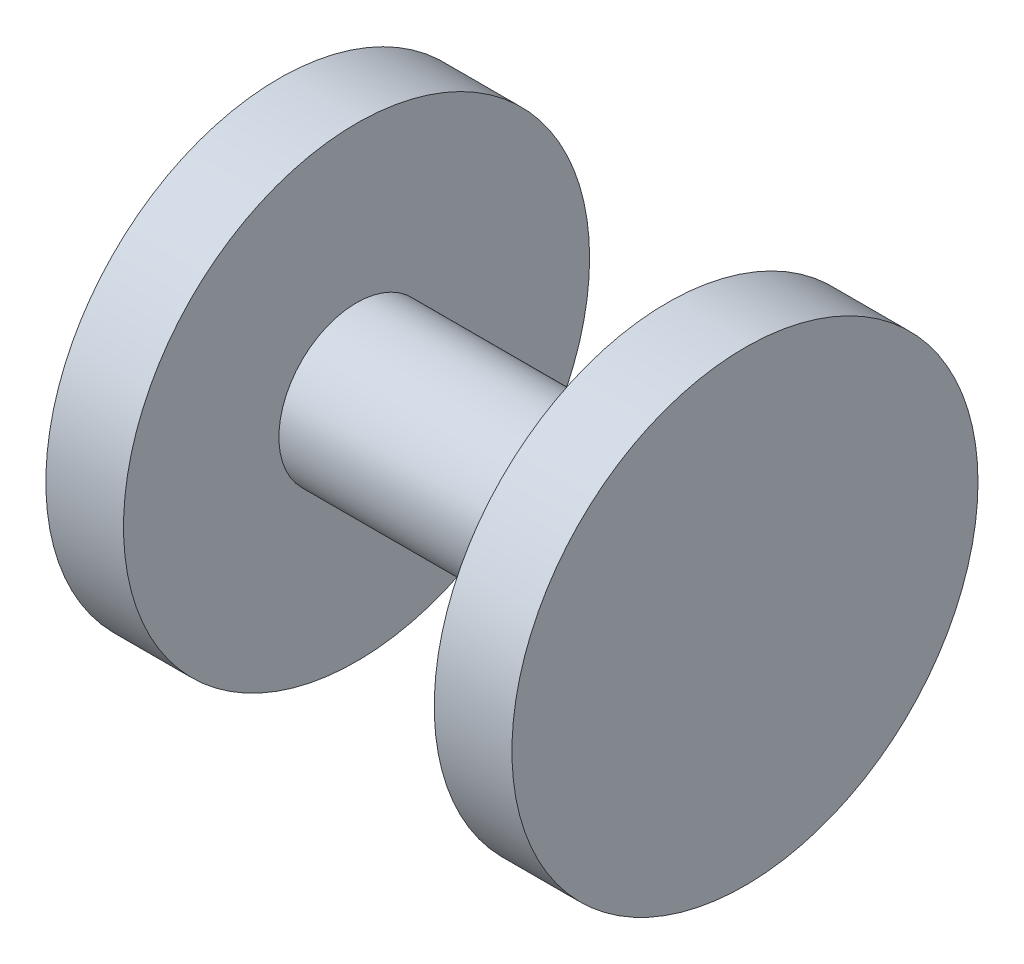
from build123d import *


with BuildPart() as part:
    # Croquis1 → Revolución1 (revolve)
    with BuildSketch(Plane.XY, mode=Mode.PRIVATE) as revoluci_n1_sk:
        Polygon((0, 0), (0, 15), (5, 15), (5, 5), (25, 5), (25, 15), (30, 15), (30, 0), align=None)
    revolve(revoluci_n1_sk.sketch.rotate(Axis((30, 0, 0), (-1, 0, 0)), 90), axis=Axis((30, 0, 0), (-1, 0, 0)))


solid = part.part
